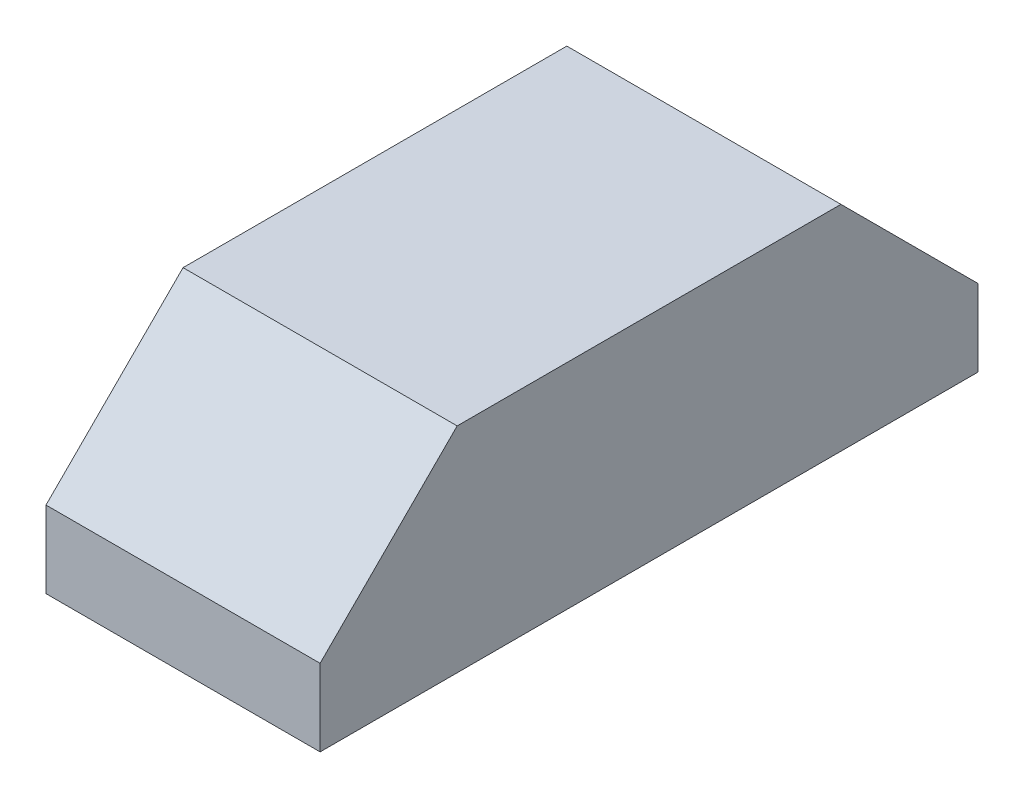
from build123d import *

# Parameters (mm, degrees)
BOSS_EXTRUDE1_DEPTH       = 5
F_3_0MM_DOWEL_HOLE1_D     = 3
F_3_0MM_DOWEL_HOLE1_DEPTH = 2
F_3_0MM_DOWEL_HOLE1_TIP   = 0.901290929


with BuildPart() as part:
    # Sketch1 → Boss-Extrude1 (new body)
    with BuildSketch(Plane(origin=(0, 0, 0), x_dir=(0, 0, -1), z_dir=(1, 0, 0))):
        Polygon((-19.494308289, 0), (-7.494308289, 0), (-7.494308289, 1.4), (-9.994308289, 3.9), (-16.994308289, 3.9), (-19.494308289, 1.4), align=None)
    extrude(amount=BOSS_EXTRUDE1_DEPTH)

    # Ø3.0mm Dowel Hole1
    with Locations(Plane(origin=(0, 0, 0), x_dir=(-1, 0, 0), z_dir=(0, -1, 0))):
        with Locations((-2.5, -13.494308289)):
            Hole(F_3_0MM_DOWEL_HOLE1_D / 2, depth=F_3_0MM_DOWEL_HOLE1_DEPTH)
            with Locations((0, 0, -(F_3_0MM_DOWEL_HOLE1_DEPTH + F_3_0MM_DOWEL_HOLE1_TIP / 2))):  # 118° drill point
                Cone(0, F_3_0MM_DOWEL_HOLE1_D / 2, F_3_0MM_DOWEL_HOLE1_TIP, mode=Mode.SUBTRACT)


solid = part.part
